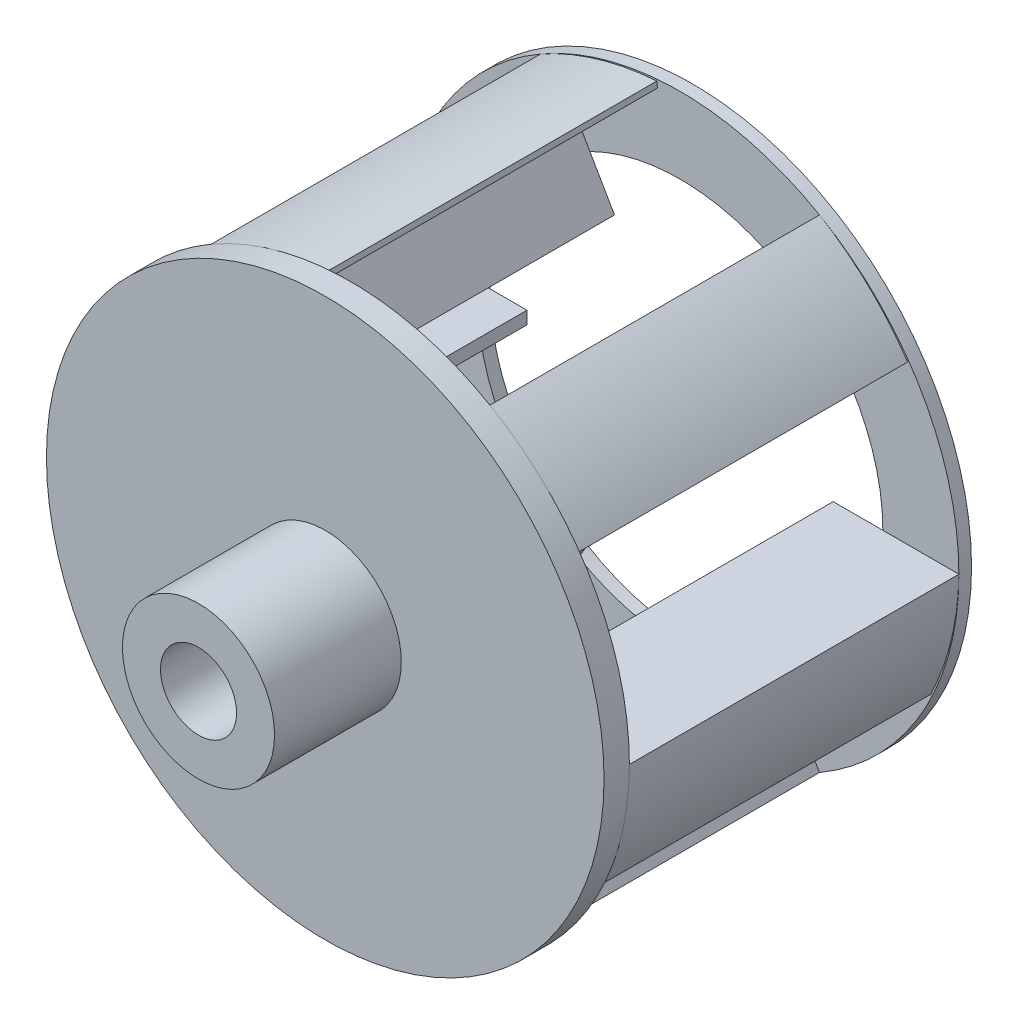
from build123d import *

# Parameters (mm, degrees)
SKETCH1_R           = 5.5
SKETCH1_R_2         = 4
BOSS_EXTRUDE1_DEPTH = 0.25
SKETCH2_R           = 5.5
BOSS_EXTRUDE2_DEPTH = 0.5
SKETCH3_R           = 1.5
BOSS_EXTRUDE3_DEPTH = 2.5
SKETCH4_R           = 0.75
CUT_EXTRUDE1_DEPTH  = 5.5
BOSS_EXTRUDE4_DEPTH = 6.5
CIRPATTERN1_COUNT   = 6


with BuildPart() as part:
    # Sketch1 → Boss-Extrude1 (new body)
    with BuildSketch(Plane.XY):
        Circle(SKETCH1_R)
        Circle(SKETCH1_R_2, mode=Mode.SUBTRACT)
    extrude(amount=BOSS_EXTRUDE1_DEPTH)



with BuildPart() as body_2:
    # Sketch2 → Boss-Extrude2 (new body)
    with BuildSketch(Plane.XY.offset(6.75)):
        Circle(SKETCH2_R)
    extrude(amount=BOSS_EXTRUDE2_DEPTH)

    # Sketch3 → Boss-Extrude3 (add)
    with BuildSketch(Plane.XY.offset(7.25)):
        Circle(SKETCH3_R)
    extrude(amount=BOSS_EXTRUDE3_DEPTH)

    # Sketch4 → Cut-Extrude1 (cut)
    with BuildSketch(Plane.XY.offset(9.75)):
        Circle(SKETCH4_R)
    extrude(amount=-CUT_EXTRUDE1_DEPTH, mode=Mode.SUBTRACT)


with BuildPart() as part_1:
    add(part.part)

    add(body_2.part)  # Boss-Extrude4 merges body 2
    # Sketch5 → Boss-Extrude4 (add)
    with BuildSketch(Plane.XY.offset(0.25)):
        with BuildLine():
            ThreePointArc((5.490711407, -0.25), (5.496777174, -0.125052814), (5.5, 0))
            Line((5.5, 0), (3.02, 0))
            Line((3.02, 0), (3.02, -0.25))
            Line((3.02, -0.25), (5.344155686, -0.25))
            ThreePointArc((5.344155686, -0.25), (5.192402288, -1.288975749), (4.840644628, -2.278301908))
            Line((4.840644628, -2.278301908), (4.945949887, -2.327864971))
            ThreePointArc((4.945949887, -2.327864971), (5.32074764, -1.315783526), (5.490711407, -0.25))
        make_face()
    boss_extrude4 = extrude(amount=BOSS_EXTRUDE4_DEPTH)

    # CirPattern1: Boss-Extrude4 ×6 about axis
    cirpattern1_axis = Axis((0, 0, 0), (0, 0, 1))
    for i in range(1, CIRPATTERN1_COUNT):
        add(boss_extrude4.rotate(cirpattern1_axis, i * 360 / CIRPATTERN1_COUNT))


solid = part_1.part
